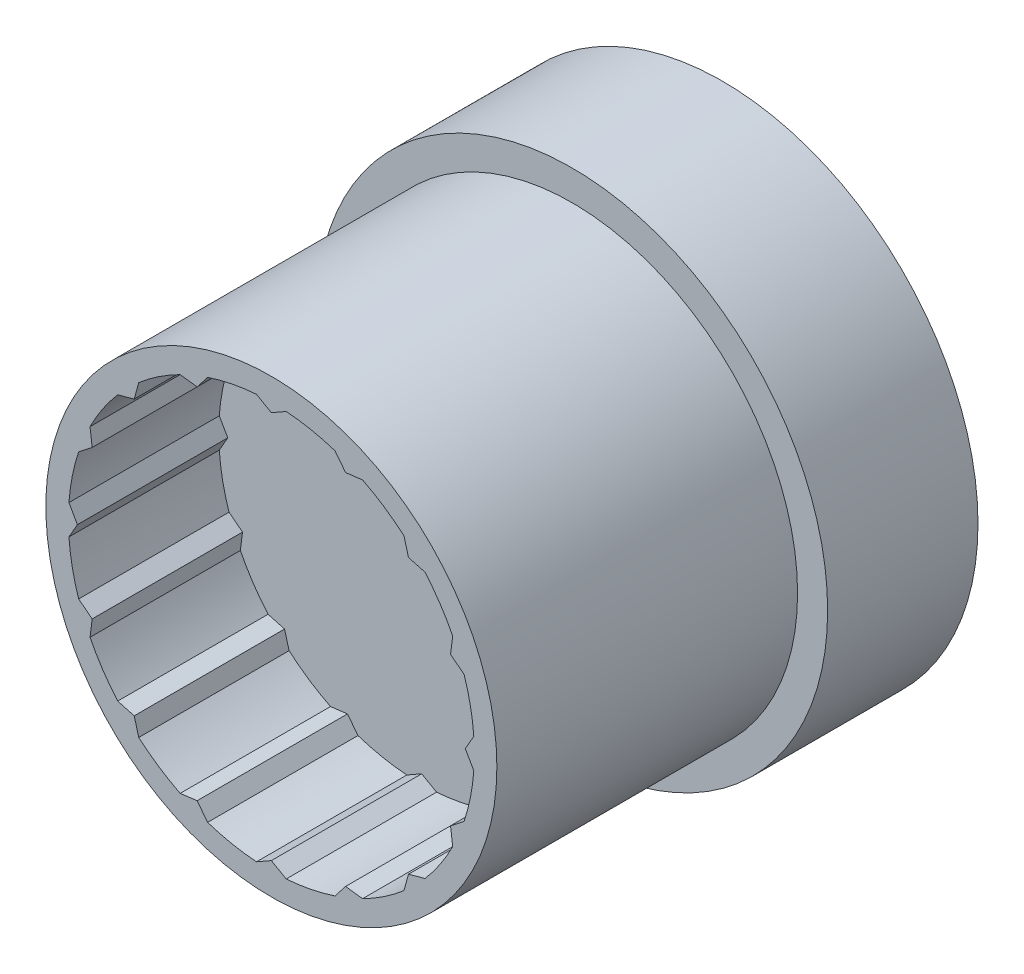
from build123d import *

# Parameters (mm, degrees)
SKETCH1_R           = 8.5
BOSS_EXTRUDE1_DEPTH = 5
SKETCH2_R           = 7.5
BOSS_EXTRUDE2_DEPTH = 10
SKETCH3_R           = 6.75
CUT_EXTRUDE1_DEPTH  = 5
BOSS_EXTRUDE5_DEPTH = 5
SKETCH5_R           = 6.270829758
SKETCH5_R_2         = 2.95954522
CUT_EXTRUDE2_DEPTH  = 1


with BuildPart() as part:
    # Sketch1 → Boss-Extrude1 (new body)
    with BuildSketch(Plane.XY):
        Circle(SKETCH1_R)
    extrude(amount=BOSS_EXTRUDE1_DEPTH)

    # Sketch2 → Boss-Extrude2 (add)
    with BuildSketch(Plane.XY.offset(5)):
        Circle(SKETCH2_R)
    extrude(amount=BOSS_EXTRUDE2_DEPTH)

    # Sketch3 → Cut-Extrude1 (cut)
    with BuildSketch(Plane.XY.offset(15)):
        Circle(SKETCH3_R)
    extrude(amount=-CUT_EXTRUDE1_DEPTH, mode=Mode.SUBTRACT)

    # Sketch4 → Boss-Extrude5 (add)
    with BuildSketch(Plane.XY.offset(15)):
        Polygon((-6.45, 0), (-6.877641054, 0.75), (-6.877641054, -0.75), align=None)
        Polygon((-6.067099227, 3.324868934), (-6.641124376, 1.939049636), (-5.959022985, 2.468308139), align=None)
        Polygon((-4.332896542, 5.393556714), (-5.393556714, 4.332896542), (-4.560838739, 4.560838739), align=None)
        Polygon((-1.939049636, 6.641124376), (-3.324868934, 6.067099227), (-2.468308139, 5.959022985), align=None)
        Polygon((0.75, 6.877641054), (-0.75, 6.877641054), (0, 6.45), align=None)
        Polygon((3.324868934, 6.067099227), (1.939049636, 6.641124376), (2.468308139, 5.959022985), align=None)
        Polygon((5.393556714, 4.332896542), (4.332896542, 5.393556714), (4.560838739, 4.560838739), align=None)
        Polygon((6.641124376, 1.939049636), (6.067099227, 3.324868934), (5.959022985, 2.468308139), align=None)
        Polygon((6.877641054, -0.75), (6.877641054, 0.75), (6.45, 0), align=None)
        Polygon((6.067099227, -3.324868934), (6.641124376, -1.939049636), (5.959022985, -2.468308139), align=None)
        Polygon((4.332896542, -5.393556714), (5.393556714, -4.332896542), (4.560838739, -4.560838739), align=None)
        Polygon((1.939049636, -6.641124376), (3.324868934, -6.067099227), (2.468308139, -5.959022985), align=None)
        Polygon((-0.75, -6.877641054), (0.75, -6.877641054), (0, -6.45), align=None)
        Polygon((-3.324868934, -6.067099227), (-1.939049636, -6.641124376), (-2.468308139, -5.959022985), align=None)
        Polygon((-5.393556714, -4.332896542), (-4.332896542, -5.393556714), (-4.560838739, -4.560838739), align=None)
        Polygon((-6.641124376, -1.939049636), (-6.067099227, -3.324868934), (-5.959022985, -2.468308139), align=None)
    extrude(amount=-BOSS_EXTRUDE5_DEPTH)

    # Sketch5 → Cut-Extrude2 (cut)
    with BuildSketch(Plane(origin=(0, 0, 0), x_dir=(-1, 0, 0), z_dir=(0, 0, -1))):
        Circle(SKETCH5_R)
        Circle(SKETCH5_R_2, mode=Mode.SUBTRACT)
    extrude(amount=-CUT_EXTRUDE2_DEPTH, mode=Mode.SUBTRACT)


solid = part.part
